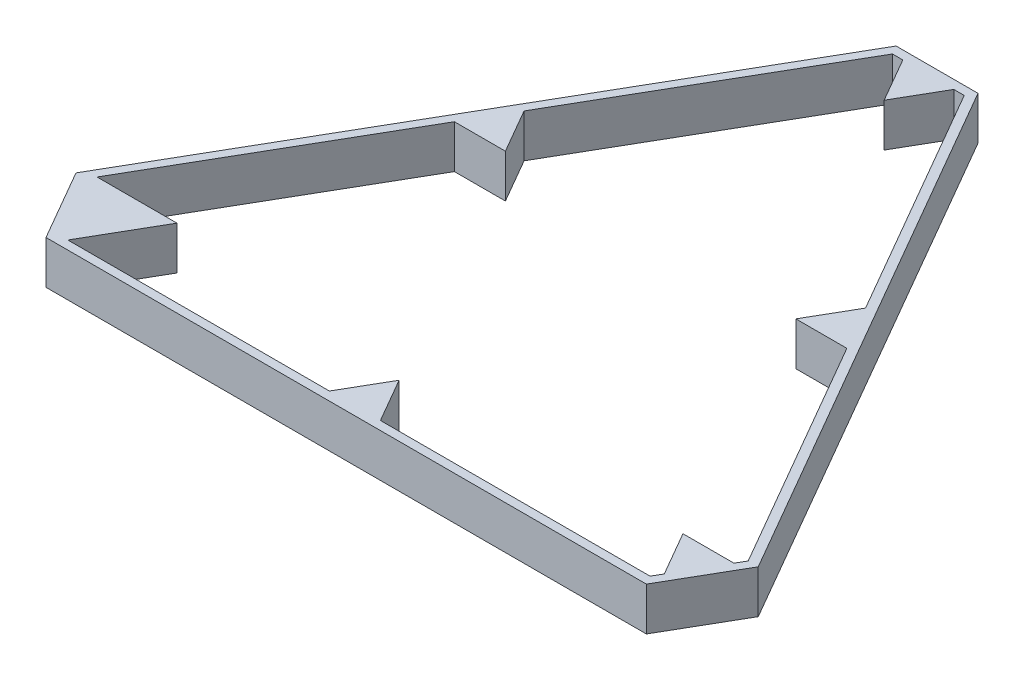
from build123d import *

# Parameters (mm, degrees)
BOSS_EXTRUDE1_DEPTH = 12.38


with BuildPart() as part:
    # Sketch1 → Boss-Extrude1 (new body)
    with BuildSketch(Plane(origin=(0, 0, 0), x_dir=(1, 0, 0), z_dir=(0, 1, 0))):
        Polygon((-11.732050803, 167.865334802), (11.732050803, 167.865334802), (97.741669748, 18.89230485), (86.00961895, -1.428203229), (-86.009618944, -1.428203229), (-97.741669751, 18.892304845), align=None)
        Polygon((41.607695163, 85.798692796), (56.226497316, 85.798692796), (94.854918412, 18.892304841), (93.36528139, 16.312177834), (78.746479233, 16.312177834), (86.055880312, 3.651923793), (84.566243293, 1.071796793), (7.309401088, 1.071796793), (2e-09, 13.732050847), (-7.309401083, 1.071796796), (-82.256842179, 1.071796796), (-70.813466519, 20.892304849), (-93.70021784, 20.892304849), (-56.226497283, 85.798692801), (-41.60769513, 85.798692801), (-48.917096207, 98.458946839), (-10.288675112, 165.365334792), (-7.309401077, 165.365334792), (0, 152.705080754), (7.309401077, 165.365334792), (10.288675142, 165.365334792), (48.91709624, 98.458946834), align=None, mode=Mode.SUBTRACT)
    extrude(amount=BOSS_EXTRUDE1_DEPTH)


solid = part.part
